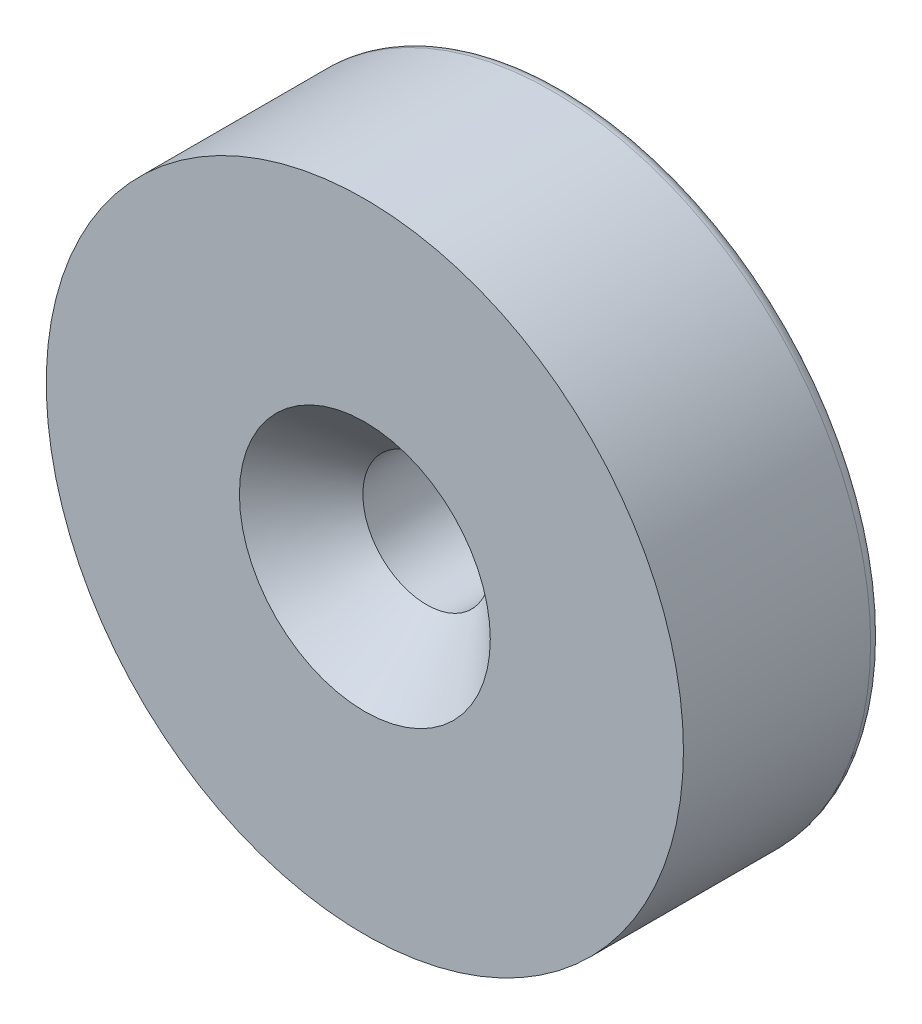
from build123d import *

# Parameters (mm, degrees)
ESBO_O1_R                                            = 8
RESSALTO_EXTRUS_O1_DEPTH                             = 5
FORMSENKUNG_F_R_M3_LINSENSENKSCHRAUBE_MI_D           = 3.2
FORMSENKUNG_F_R_M3_LINSENSENKSCHRAUBE_MI_DEPTH       = 20.87
FORMSENKUNG_F_R_M3_LINSENSENKSCHRAUBE_MI_CSINK_D     = 6.3
FORMSENKUNG_F_R_M3_LINSENSENKSCHRAUBE_MI_CSINK_ANGLE = 90
FORMSENKUNG_F_R_M3_LINSENSENKSCHRAUBE_MI_TIP         = 0.96137699
FILETE1_R                                            = 0.3


with BuildPart() as part:
    # Esboço1 → Ressalto-extrusão1 (new body)
    with BuildSketch(Plane.XY):
        Circle(ESBO_O1_R)
    extrude(amount=RESSALTO_EXTRUS_O1_DEPTH)

    # Formsenkung für M3 Linsensenkschraube mit Schlitz1
    with Locations(Plane.XY.offset(5)):
        with Locations((0, 0)):
            CounterSinkHole(FORMSENKUNG_F_R_M3_LINSENSENKSCHRAUBE_MI_D / 2, FORMSENKUNG_F_R_M3_LINSENSENKSCHRAUBE_MI_CSINK_D / 2, depth=FORMSENKUNG_F_R_M3_LINSENSENKSCHRAUBE_MI_DEPTH, counter_sink_angle=FORMSENKUNG_F_R_M3_LINSENSENKSCHRAUBE_MI_CSINK_ANGLE)
            with Locations((0, 0, -(FORMSENKUNG_F_R_M3_LINSENSENKSCHRAUBE_MI_DEPTH + FORMSENKUNG_F_R_M3_LINSENSENKSCHRAUBE_MI_TIP / 2))):  # 118° drill point
                Cone(0, FORMSENKUNG_F_R_M3_LINSENSENKSCHRAUBE_MI_D / 2, FORMSENKUNG_F_R_M3_LINSENSENKSCHRAUBE_MI_TIP, mode=Mode.SUBTRACT)

    # Filete1
    filete1_edges = [part.edges().sort_by_distance(p)[0] for p in [
        (-8, 0, 0),
    ]]
    fillet(filete1_edges, radius=FILETE1_R)


solid = part.part
